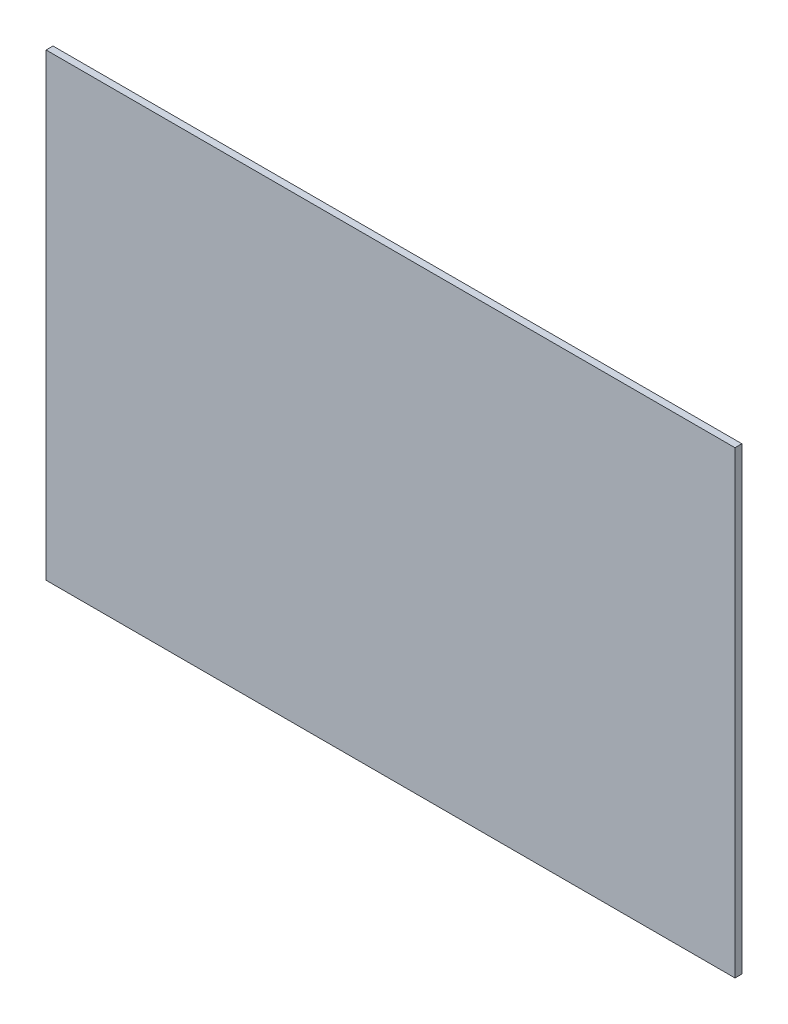
from build123d import *

# Parameters (mm, degrees)
SKETCH1_W           = 1500
SKETCH1_H           = 1000
BOSS_EXTRUDE1_DEPTH = 15


with BuildPart() as part:
    # Sketch1 → Boss-Extrude1 (new body)
    with BuildSketch(Plane.XY):
        with Locations((-23.578146815, -20.161290323)):
            Rectangle(SKETCH1_W, SKETCH1_H)
    extrude(amount=BOSS_EXTRUDE1_DEPTH)


solid = part.part
